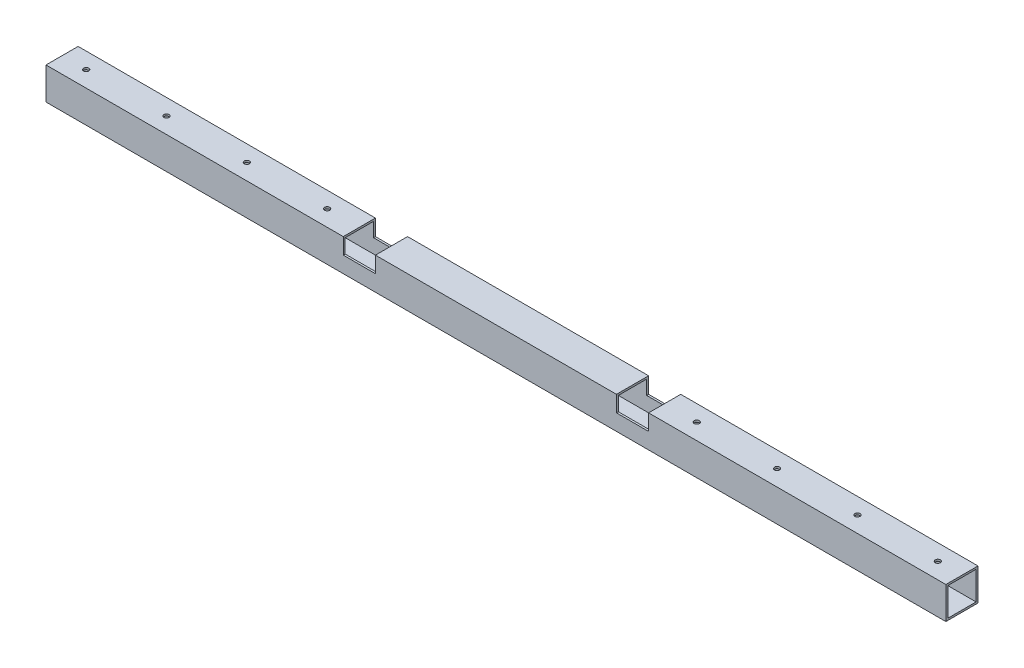
from build123d import *

# Parameters (mm, degrees)
SKETCH_1_W          = 20
SKETCH_1_H          = 20
SKETCH_1_W_2        = 17.6
SKETCH_1_H_2        = 17.6
EXTRUDE_1_DEPTH     = 280
SKETCH_2_W          = 20
SKETCH_2_H          = 10
CUT_EXTRUDE_1_DEPTH = 281.891438104
SKETCH_3_R          = 1.6
CUT_EXTRUDE_2_DEPTH = 281.891438104
CUT_EXTRUDE_3_REACH = 282.891
SKETCH_4_R          = 2.5


with BuildPart() as part:
    # 草图1 → 凸台-拉伸1 (new, symmetric)
    with BuildSketch(Plane(origin=(0, 0, 0), x_dir=(0, 0, -1), z_dir=(1, 0, 0))):
        Rectangle(SKETCH_1_W, SKETCH_1_H)
        Rectangle(SKETCH_1_W_2, SKETCH_1_H_2, mode=Mode.SUBTRACT)
    extrude(amount=EXTRUDE_1_DEPTH, both=True)

    # 草图2 → 切除-拉伸1 (cut, through all)
    with BuildSketch(Plane(origin=(0, 0, -10), x_dir=(-1, 0, 0), z_dir=(0, 0, -1))):
        with Locations((-85, 5)):
            Rectangle(SKETCH_2_W, SKETCH_2_H)
        with Locations((85, 5)):
            Rectangle(SKETCH_2_W, SKETCH_2_H)
    extrude(amount=-CUT_EXTRUDE_1_DEPTH, mode=Mode.SUBTRACT)

    # 草图3 → 切除-拉伸2 (cut, through all)
    with BuildSketch(Plane(origin=(0, 10, 0), x_dir=(1, 0, 0), z_dir=(0, 1, 0))):
        with Locations(Location((115, 0, 0), (0, 0, 270))):
            Circle(SKETCH_3_R)
        with Locations(Location((165, 0, 0), (0, 0, 270))):
            Circle(SKETCH_3_R)
        with Locations(Location((265, 0, 0), (0, 0, 270))):
            Circle(SKETCH_3_R)
        with Locations(Location((215, 0, 0), (0, 0, 270))):
            Circle(SKETCH_3_R)
        with Locations(Location((-215, 0, 0), (0, 0, 270))):
            Circle(SKETCH_3_R)
        with Locations(Location((-265, 0, 0), (0, 0, 270))):
            Circle(SKETCH_3_R)
        with Locations(Location((-115, 0, 0), (0, 0, 270))):
            Circle(SKETCH_3_R)
        with Locations(Location((-165, 0, 0), (0, 0, 270))):
            Circle(SKETCH_3_R)
    extrude(amount=-CUT_EXTRUDE_2_DEPTH, mode=Mode.SUBTRACT)

    # 草图4 → 切除-拉伸3 (cut, up to next)
    with BuildSketch(Plane.XZ.offset(10), mode=Mode.PRIVATE) as cut_extrude_3_sk1:
        with Locations(Location((240, 0, 0), (0, 0, 270))):
            Circle(SKETCH_4_R)
    cut_extrude_3_tool1 = extrude(cut_extrude_3_sk1.sketch, amount=-CUT_EXTRUDE_3_REACH, mode=Mode.PRIVATE) & part.part
    # 草图4 → 切除-拉伸3 (cut, up to next)
    with BuildSketch(Plane.XZ.offset(10), mode=Mode.PRIVATE) as cut_extrude_3_sk2:
        with Locations(Location((-240, 0, 0), (0, 0, 90))):
            Circle(SKETCH_4_R)
    cut_extrude_3_tool2 = extrude(cut_extrude_3_sk2.sketch, amount=-CUT_EXTRUDE_3_REACH, mode=Mode.PRIVATE) & part.part
    # 草图4 → 切除-拉伸3 (cut, up to next)
    with BuildSketch(Plane.XZ.offset(10), mode=Mode.PRIVATE) as cut_extrude_3_sk3:
        with Locations(Location((190, 0, 0), (0, 0, 270))):
            Circle(SKETCH_4_R)
    cut_extrude_3_tool3 = extrude(cut_extrude_3_sk3.sketch, amount=-CUT_EXTRUDE_3_REACH, mode=Mode.PRIVATE) & part.part
    # 草图4 → 切除-拉伸3 (cut, up to next)
    with BuildSketch(Plane.XZ.offset(10), mode=Mode.PRIVATE) as cut_extrude_3_sk4:
        with Locations(Location((140, 0, 0), (0, 0, 270))):
            Circle(SKETCH_4_R)
    cut_extrude_3_tool4 = extrude(cut_extrude_3_sk4.sketch, amount=-CUT_EXTRUDE_3_REACH, mode=Mode.PRIVATE) & part.part
    # 草图4 → 切除-拉伸3 (cut, up to next)
    with BuildSketch(Plane.XZ.offset(10), mode=Mode.PRIVATE) as cut_extrude_3_sk5:
        with Locations(Location((-140, 0, 0), (0, 0, 90))):
            Circle(SKETCH_4_R)
    cut_extrude_3_tool5 = extrude(cut_extrude_3_sk5.sketch, amount=-CUT_EXTRUDE_3_REACH, mode=Mode.PRIVATE) & part.part
    # 草图4 → 切除-拉伸3 (cut, up to next)
    with BuildSketch(Plane.XZ.offset(10), mode=Mode.PRIVATE) as cut_extrude_3_sk6:
        with Locations(Location((-190, 0, 0), (0, 0, 90))):
            Circle(SKETCH_4_R)
    cut_extrude_3_tool6 = extrude(cut_extrude_3_sk6.sketch, amount=-CUT_EXTRUDE_3_REACH, mode=Mode.PRIVATE) & part.part
    add(cut_extrude_3_tool1.solids().sort_by_distance((240, -10, 0))[0], mode=Mode.SUBTRACT)
    add(cut_extrude_3_tool2.solids().sort_by_distance((-240, -10, 0))[0], mode=Mode.SUBTRACT)
    add(cut_extrude_3_tool3.solids().sort_by_distance((190, -10, 0))[0], mode=Mode.SUBTRACT)
    add(cut_extrude_3_tool4.solids().sort_by_distance((140, -10, 0))[0], mode=Mode.SUBTRACT)
    add(cut_extrude_3_tool5.solids().sort_by_distance((-140, -10, 0))[0], mode=Mode.SUBTRACT)
    add(cut_extrude_3_tool6.solids().sort_by_distance((-190, -10, 0))[0], mode=Mode.SUBTRACT)


solid = part.part
